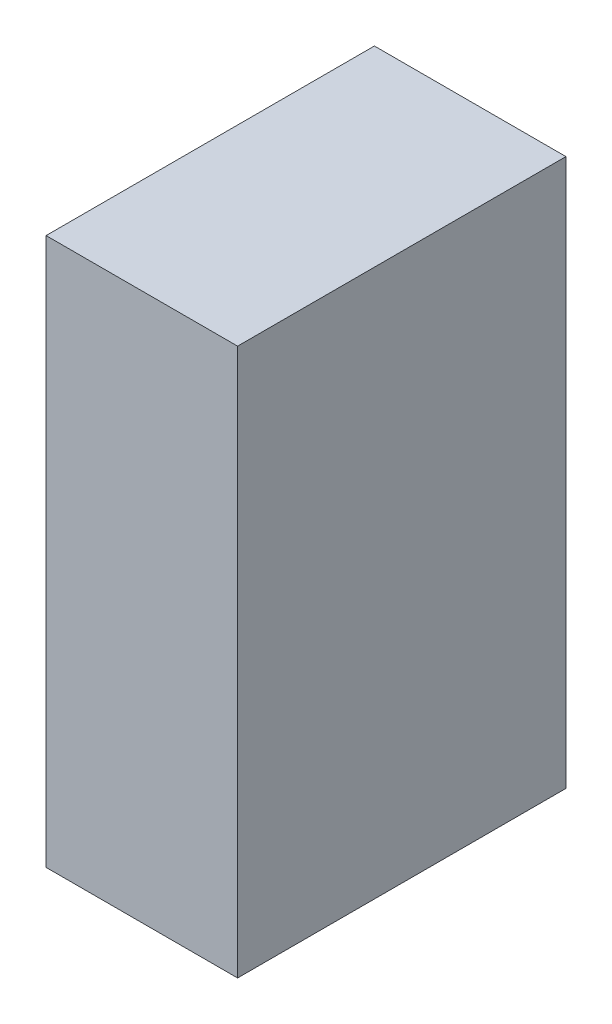
from build123d import *

# Parameters (mm, degrees)
PACK_PANO_SERVO_SURUCU_2_1_START = -188
SKETCH1_W                        = 35
SKETCH1_H                        = 100
PACK_PANO_SERVO_SURUCU_2_1_DEPTH = 60


with BuildPart() as part:
    # Sketch1 → PACK_pano_servo_surucu_2_1 (new body)
    with BuildSketch(Plane.XY.offset(PACK_PANO_SERVO_SURUCU_2_1_START)):
        with Locations((582.5, 230)):
            Rectangle(SKETCH1_W, SKETCH1_H)
    extrude(amount=-PACK_PANO_SERVO_SURUCU_2_1_DEPTH)


solid = part.part
